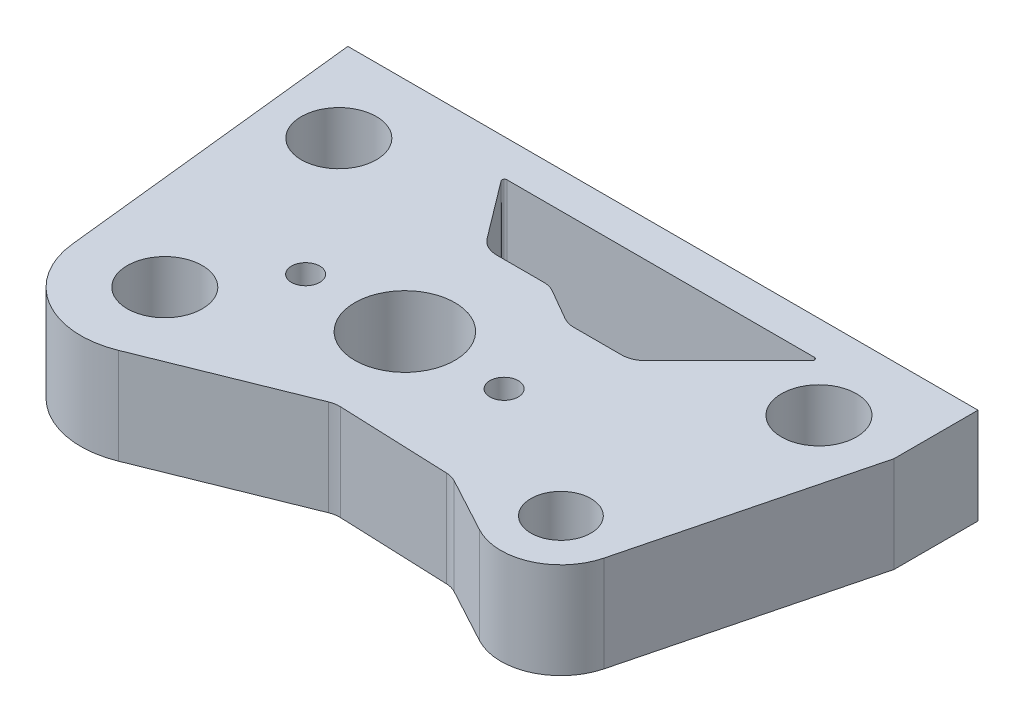
from build123d import *

# Parameters (mm, degrees)
SKETCH4_R           = 3.96875
SKETCH4_R_2         = 5.2959
SKETCH4_R_3         = 1.5
SKETCH4_R_4         = 3.175
BOSS_EXTRUDE2_DEPTH = 10.16


with BuildPart() as part:
    # Sketch4 → Boss-Extrude2 (new body)
    with BuildSketch(Plane(origin=(0, 0, 0), x_dir=(1, 0, 0), z_dir=(0, 1, 0))):
        with BuildLine():
            Line((54.2925, 31.75), (-12.3825, 31.75))
            Line((-12.3825, 31.75), (-8.838261623, -0.957722033))
            ThreePointArc((-8.838261623, -0.957722033), (-4.569283935, -7.625860235), (3.324048375, -8.245168428))
            Line((3.324048375, -8.245168428), (19.191308787, -1.848265606))
            ThreePointArc((19.191308787, -1.848265606), (19.706480828, -1.70147711), (20.240980706, -1.665995068))
            Line((20.240980706, -1.665995068), (31.935252388, -2.1264974))
            ThreePointArc((31.935252388, -2.1264974), (32.505817446, -2.214628745), (33.041741732, -2.429330346))
            Line((33.041741732, -2.429330346), (38.89391711, -5.588))
            ThreePointArc((38.89391711, -5.588), (44.459162112, -5.815863868), (48.063098072, -1.569039233))
            Line((48.063098072, -1.569039233), (54.2925, 22.86))
            Line((54.2925, 22.86), (54.2925, 31.75))
        make_face()
        with Locations(Location((0, 0, 0), (0, 0, 270))):
            Circle(SKETCH4_R, mode=Mode.SUBTRACT)
        with Locations(Location((46.355, 22.86, 0), (0, 0, 270))):
            Circle(SKETCH4_R, mode=Mode.SUBTRACT)
        with Locations(Location((-4.445, 22.86, 0), (0, 0, 270))):
            Circle(SKETCH4_R, mode=Mode.SUBTRACT)
        with Locations(Location((16.764, 8.636, 0), (0, 0, 270))):
            Circle(SKETCH4_R_2, mode=Mode.SUBTRACT)
        with Locations(Location((27.264, 8.636, 0), (0, 0, 270))):
            Circle(SKETCH4_R_3, mode=Mode.SUBTRACT)
        with Locations(Location((6.264, 8.636, 0), (0, 0, 270))):
            Circle(SKETCH4_R_3, mode=Mode.SUBTRACT)
        with Locations(Location((41.91, 0, 0), (0, 0, 270))):
            Circle(SKETCH4_R_4, mode=Mode.SUBTRACT)
        with BuildLine():
            Line((40.788789755, 27.94), (8.256445186, 27.94))
            ThreePointArc((8.256445186, 27.94), (8.029131858, 27.799334245), (8.053591766, 27.533138984))
            Line((8.053591766, 27.533138984), (12.594862372, 21.506669344))
            ThreePointArc((12.594862372, 21.506669344), (13.490054122, 20.762146224), (14.623396567, 20.495279502))
            Line((14.623396567, 20.495279502), (19.573752381, 20.495279502))
            ThreePointArc((19.573752381, 20.495279502), (20.231152756, 20.408731101), (20.843752381, 20.154984028))
            Line((20.843752381, 20.154984028), (24.06434333, 18.295574977))
            ThreePointArc((24.06434333, 18.295574977), (24.676942955, 18.041827904), (25.33434333, 17.955279502))
            Line((25.33434333, 17.955279502), (30.365177054, 17.955279502))
            ThreePointArc((30.365177054, 17.955279502), (31.337192972, 18.14862549), (32.161228278, 18.699228278))
            Line((32.161228278, 18.699228278), (40.968394878, 27.506394878))
            ThreePointArc((40.968394878, 27.506394878), (41.023455156, 27.783201592), (40.788789755, 27.94))
        make_face(mode=Mode.SUBTRACT)
    extrude(amount=BOSS_EXTRUDE2_DEPTH)


solid = part.part
